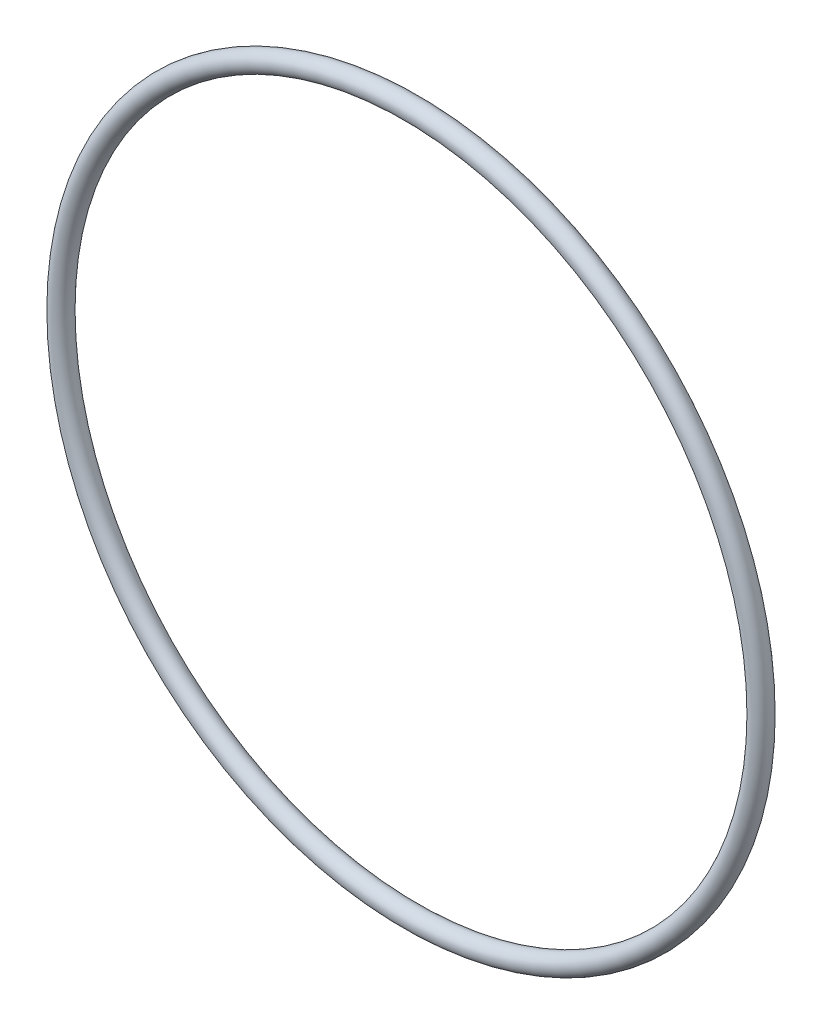
from build123d import *

# Parameters (mm, degrees)
SKETCH1_R = 1.7653


with BuildPart() as part:
    # Sketch1 → Revolve1 (revolve)
    with BuildSketch(Plane(origin=(0, 0, 0), x_dir=(0, -1, 0), z_dir=(1, 0, 0)), mode=Mode.PRIVATE) as revolve1_sk:
        with Locations((61.8871, 0)):
            Circle(SKETCH1_R)
    revolve(revolve1_sk.sketch.rotate(Axis((0, 0, 1.7653), (0, 0, -1)), 270), axis=Axis((0, 0, 1.7653), (0, 0, -1)))


solid = part.part
